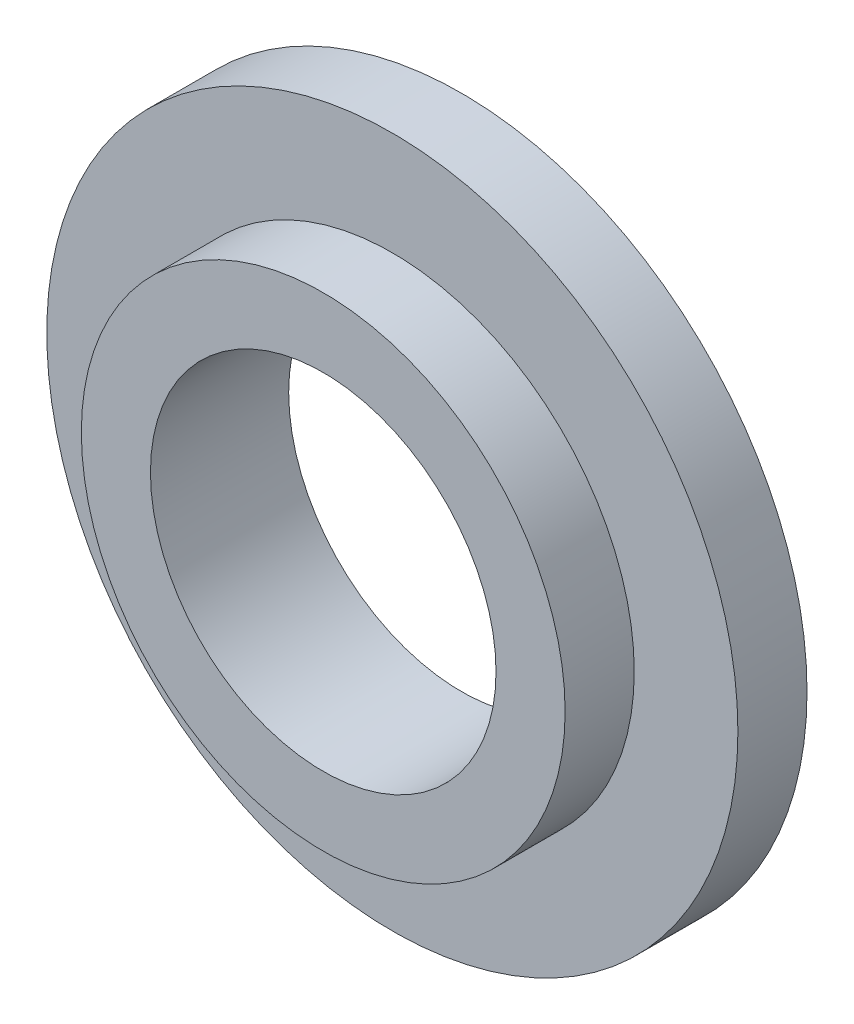
from build123d import *

# Parameters (mm, degrees)
SKETCH_1_R          = 5
EXTRUDE_1_DEPTH     = 1
SKETCH_2_R          = 3.5
SKETCH_2_R_2        = 2.5
EXTRUDE_2_DEPTH     = 1
CUT_EXTRUDE_START   = -5
SKETCH_3_R          = 2.5
CUT_EXTRUDE_1_DEPTH = 5


with BuildPart() as part:
    # 草图1 → 凸台-拉伸1 (new body)
    with BuildSketch(Plane.XY):
        Circle(SKETCH_1_R)
    extrude(amount=EXTRUDE_1_DEPTH)

    # 草图2 → 凸台-拉伸2 (add)
    with BuildSketch(Plane.XY.offset(1)):
        Circle(SKETCH_2_R)
        Circle(SKETCH_2_R_2, mode=Mode.SUBTRACT)
    extrude(amount=EXTRUDE_2_DEPTH)

    # 草图3 → 切除-拉伸1 (cut)
    with BuildSketch(Plane.XY.offset(1).offset(CUT_EXTRUDE_START)):
        Circle(SKETCH_3_R)
    extrude(amount=CUT_EXTRUDE_1_DEPTH, mode=Mode.SUBTRACT)


solid = part.part
